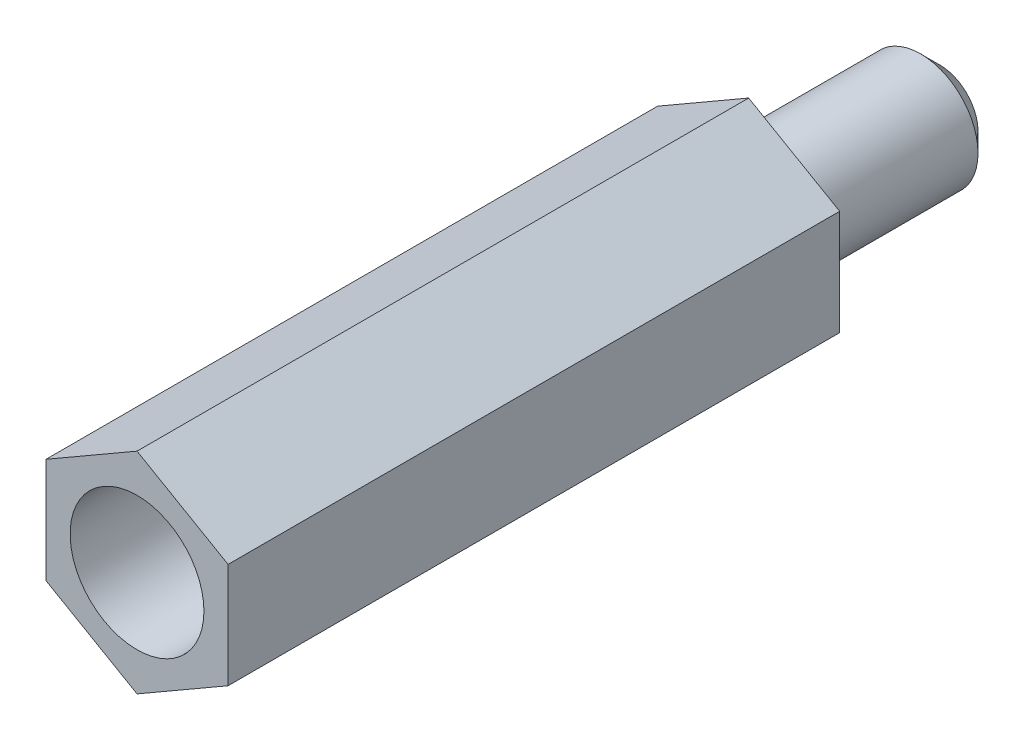
from build123d import *

# Parameters (mm, degrees)
BOSS_EXTRUDE1_DEPTH = 16
SKETCH2_R           = 1.75
CUT_EXTRUDE1_DEPTH  = 8
SKETCH3_R           = 1.5
BOSS_EXTRUDE2_DEPTH = 5
CHAMFER1_SIZE       = 0.5


with BuildPart() as part:
    # Sketch1 → Boss-Extrude1 (new body)
    with BuildSketch(Plane.XY):
        Polygon((0, 2.75), (-2.38156986, 1.375), (-2.38156986, -1.375), (0, -2.75), (2.38156986, -1.375), (2.38156986, 1.375), align=None)
    extrude(amount=BOSS_EXTRUDE1_DEPTH)

    # Sketch2 → Cut-Extrude1 (cut)
    with BuildSketch(Plane.XY.offset(16)):
        Circle(SKETCH2_R)
    extrude(amount=-CUT_EXTRUDE1_DEPTH, mode=Mode.SUBTRACT)

    # Sketch3 → Boss-Extrude2 (add)
    with BuildSketch(Plane(origin=(0, 0, 0), x_dir=(-1, 0, 0), z_dir=(0, 0, -1))):
        with Locations(Location((0, 0, 0), (0, 0, 180))):
            Circle(SKETCH3_R)
    extrude(amount=BOSS_EXTRUDE2_DEPTH)

    # Chamfer1
    chamfer1_edges = [part.edges().sort_by_distance(p)[0] for p in [
        (-1.5, 0, -5),
    ]]
    chamfer(chamfer1_edges, length=CHAMFER1_SIZE)


solid = part.part
